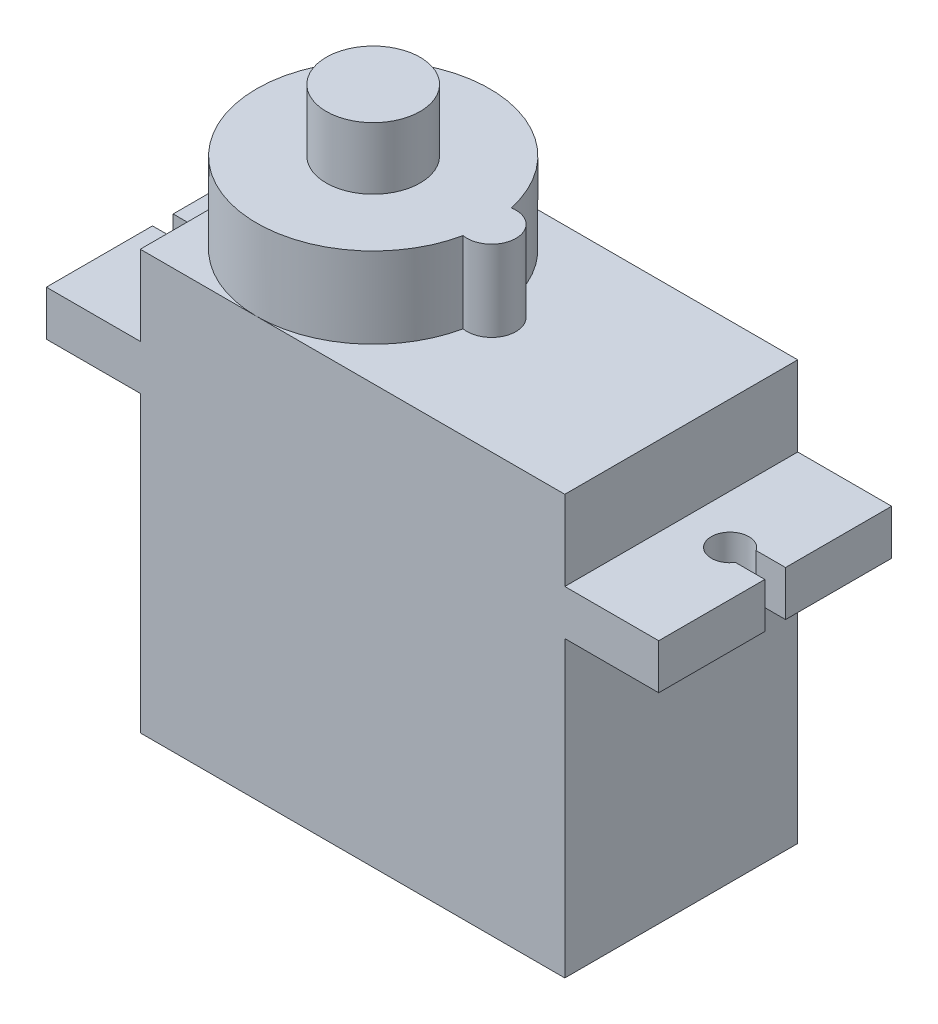
from build123d import *

# Parameters (mm, degrees)
SKETCH1_W             = 22.6
SKETCH1_H             = 12.4
BOSS_EXTRUDE1_DEPTH   = 22.3
SKETCH2_W             = 12.4
SKETCH2_H             = 2.4
BOSS_EXTRUDE2_DEPTH   = 5
SKETCH3_W             = 12.4
SKETCH3_H             = 2.4
BOSS_EXTRUDE3_DEPTH   = 5
CUT_EXTRUDE1_REACH    = 27.098
BOSS_EXTRUDE4_DEPTH   = 4.3
SKETCH7_R             = 2.5
BOSS_EXTRUDE5_DEPTH   = 3.3
SKETCH8_R             = 0.6
BOSS_EXTRUDE7_DEPTH   = 2.3
BOSS_EXTRUDE7_2_DEPTH = 2.3
BOSS_EXTRUDE7_3_DEPTH = 2.3


with BuildPart() as part:
    # Sketch1 → Boss-Extrude1 (new body)
    with BuildSketch(Plane(origin=(0, 0, 0), x_dir=(1, 0, 0), z_dir=(0, 1, 0))):
        Rectangle(SKETCH1_W, SKETCH1_H)
    extrude(amount=BOSS_EXTRUDE1_DEPTH)

    # Sketch2 → Boss-Extrude2 (add)
    with BuildSketch(Plane(origin=(11.3, 0, 0), x_dir=(0, 0, -1), z_dir=(1, 0, 0))):
        with Locations((0, 16.85)):
            Rectangle(SKETCH2_W, SKETCH2_H)
    extrude(amount=BOSS_EXTRUDE2_DEPTH)

    # Sketch3 → Boss-Extrude3 (add)
    with BuildSketch(Plane.ZY.offset(11.3)):
        with Locations((0, 16.85)):
            Rectangle(SKETCH3_W, SKETCH3_H)
    extrude(amount=BOSS_EXTRUDE3_DEPTH)

    # Sketch4 → Cut-Extrude1 (cut, up to next)
    with BuildSketch(Plane(origin=(0, 18.05, 0), x_dir=(1, 0, 0), z_dir=(0, 1, 0)), mode=Mode.PRIVATE) as cut_extrude1_sk1:
        with BuildLine():
            Line((-16.3, 0.55), (-14.735164654, 0.55))
            ThreePointArc((-14.735164654, 0.55), (-12.9, 0), (-14.735164654, -0.55))
            Line((-14.735164654, -0.55), (-16.3, -0.55))
            Line((-16.3, -0.55), (-16.3, 0.55))
        make_face()
    cut_extrude1_tool1 = extrude(cut_extrude1_sk1.sketch, amount=-CUT_EXTRUDE1_REACH, mode=Mode.PRIVATE) & part.part
    # Sketch4 → Cut-Extrude1 (cut, up to next)
    with BuildSketch(Plane(origin=(0, 18.05, 0), x_dir=(1, 0, 0), z_dir=(0, 1, 0)), mode=Mode.PRIVATE) as cut_extrude1_sk2:
        with BuildLine():
            Line((16.3, -0.55), (14.735164654, -0.55))
            ThreePointArc((14.735164654, -0.55), (12.9, 0), (14.735164654, 0.55))
            Line((14.735164654, 0.55), (16.3, 0.55))
            Line((16.3, 0.55), (16.3, -0.55))
        make_face()
    cut_extrude1_tool2 = extrude(cut_extrude1_sk2.sketch, amount=-CUT_EXTRUDE1_REACH, mode=Mode.PRIVATE) & part.part
    add(cut_extrude1_tool1.solids().sort_by_distance((-14.464034, 18.05, 0))[0], mode=Mode.SUBTRACT)
    add(cut_extrude1_tool2.solids().sort_by_distance((14.464034, 18.05, 0))[0], mode=Mode.SUBTRACT)

    # Sketch6 → Boss-Extrude4 (add)
    with BuildSketch(Plane(origin=(0, 22.3, 0), x_dir=(1, 0, 0), z_dir=(0, 1, 0))):
        with BuildLine():
            ThreePointArc((0.966666667, -1.278888406), (2.5, 0), (0.966666667, 1.278888406))
            ThreePointArc((0.966666667, 1.278888406), (-11.3, 0), (0.966666667, -1.278888406))
        make_face()
    extrude(amount=BOSS_EXTRUDE4_DEPTH)

    # Sketch7 → Boss-Extrude5 (add)
    with BuildSketch(Plane(origin=(0, 26.6, 0), x_dir=(1, 0, 0), z_dir=(0, 1, 0))):
        with Locations(Location((-5.1, 0, 0), (0, 0, 270))):
            Circle(SKETCH7_R)
    extrude(amount=BOSS_EXTRUDE5_DEPTH)


with BuildPart() as body_2:
    # Sketch8 → Boss-Extrude7 (new body)
    with BuildSketch(Plane.ZY.offset(11.3)):
        with Locations((0, 4.5)):
            Circle(SKETCH8_R)
    extrude(amount=BOSS_EXTRUDE7_DEPTH)


with BuildPart() as body_3:
    # Sketch8 → Boss-Extrude7 2 (new body)
    with BuildSketch(Plane.ZY.offset(11.3)):
        with Locations((-1.2, 4.5)):
            Circle(SKETCH8_R)
    extrude(amount=BOSS_EXTRUDE7_2_DEPTH)


with BuildPart() as body_4:
    # Sketch8 → Boss-Extrude7 3 (new body)
    with BuildSketch(Plane.ZY.offset(11.3)):
        with Locations((1.2, 4.5)):
            Circle(SKETCH8_R)
    extrude(amount=BOSS_EXTRUDE7_3_DEPTH)


solid = Compound([part.part, body_2.part, body_3.part, body_4.part])
